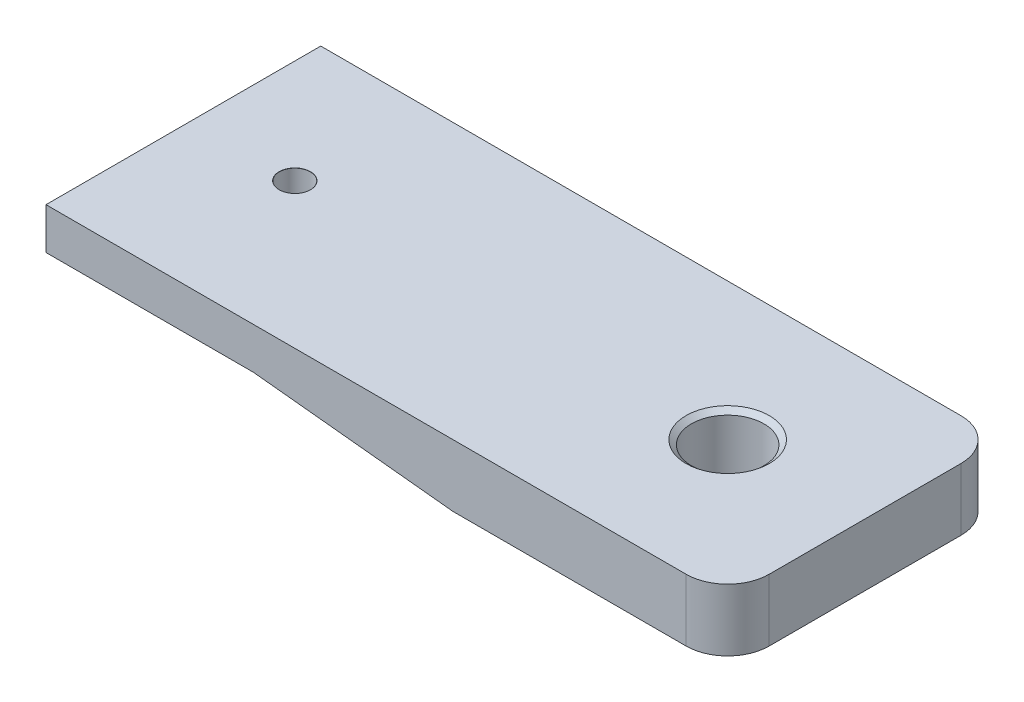
from build123d import *

# Parameters (mm, degrees)
EXTRUDE_1_DEPTH        = 53
FILLET_1_R             = 8
F_16_0MM_1_D           = 14
F_16_0MM_1_CSINK_D     = 16.05
F_16_0MM_1_CSINK_ANGLE = 100
F_6_0MM_1_D            = 6
F_6_0MM_1_CSINK_D      = 6.05
F_6_0MM_1_CSINK_ANGLE  = 100
FILLET_4_R             = 8


with BuildPart() as part:
    # 草图2 → 凸台-拉伸1 (new body)
    with BuildSketch(Plane.XY):
        Polygon((0, 0), (53, 0), (53, 12), (-78.5, 12), (-78.5, 4), (-38.5, 4), align=None)
    extrude(amount=EXTRUDE_1_DEPTH)

    # 圆角1
    fillet_1_edges = [part.edges().sort_by_distance(p)[0] for p in [
        (53, 6, 0),
    ]]
    fillet(fillet_1_edges, radius=FILLET_1_R)

    # Ø16.0mm 暗销孔1 (through all)
    with Locations(Plane(origin=(0, 12, 0), x_dir=(1, 0, 0), z_dir=(0, 1, 0))):
        with Locations((26.5, -26.5)):
            CounterSinkHole(F_16_0MM_1_D / 2, F_16_0MM_1_CSINK_D / 2, counter_sink_angle=F_16_0MM_1_CSINK_ANGLE)

    # Ø6.0mm 暗销孔1 (through all)
    with Locations(Plane(origin=(0, 12, 0), x_dir=(1, 0, 0), z_dir=(0, 1, 0))):
        with Locations((-58.5, -25)):
            CounterSinkHole(F_6_0MM_1_D / 2, F_6_0MM_1_CSINK_D / 2, counter_sink_angle=F_6_0MM_1_CSINK_ANGLE)

    # 圆角4
    fillet_4_edges = [part.edges().sort_by_distance(p)[0] for p in [
        (53, 6, 53),
    ]]
    fillet(fillet_4_edges, radius=FILLET_4_R)


solid = part.part
